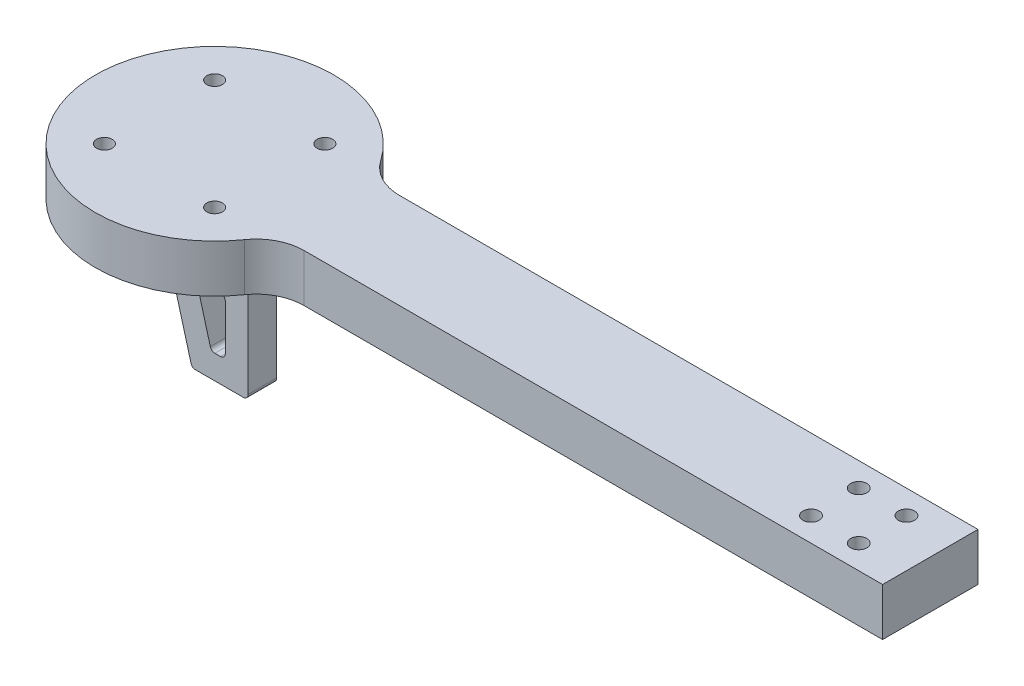
from build123d import *

# Parameters (mm, degrees)
SKETCH1_R            = 1.635
BOSS_EXTRUDE1_DEPTH  = 10
FILLET1_R            = 10
M3_CLEARANCE_HOLE1_D = 3.4
BOSS_EXTRUDE2_DEPTH  = 3


with BuildPart() as part:
    # Sketch1 → Boss-Extrude1 (new body)
    with BuildSketch(Plane(origin=(0, 0, 0), x_dir=(1, 0, 0), z_dir=(0, 1, 0))):
        with BuildLine():
            ThreePointArc((-52.087121525, 10), (-100, 0), (-52.087121525, -10))
            Line((-52.087121525, -10), (75, -10))
            Line((75, -10), (75, 10))
            Line((75, 10), (-52.087121525, 10))
        make_face()
        with Locations(Location((-63.447642962, 11.552357038, 0), (0, 0, 270))):
            Circle(SKETCH1_R, mode=Mode.SUBTRACT)
        with Locations(Location((-63.447642962, -11.552357038, 0), (0, 0, 270))):
            Circle(SKETCH1_R, mode=Mode.SUBTRACT)
        with Locations(Location((-86.552357038, -11.552357038, 0), (0, 0, 270))):
            Circle(SKETCH1_R, mode=Mode.SUBTRACT)
        with Locations(Location((-86.552357038, 11.552357038, 0), (0, 0, 270))):
            Circle(SKETCH1_R, mode=Mode.SUBTRACT)
    extrude(amount=BOSS_EXTRUDE1_DEPTH)

    # Fillet1
    fillet1_edges = [part.edges().sort_by_distance(p)[0] for p in [
        (-52.087121525, 5, -10),
        (-52.087121525, 5, 10),
    ]]
    fillet(fillet1_edges, radius=FILLET1_R)

    # M3 Clearance Hole1 (through all)
    with Locations(Plane(origin=(0, 10, 0), x_dir=(1, 0, 0), z_dir=(0, 1, 0))):
        with Locations((65, 5), (65, -5), (55, 5), (55, -5)):
            Hole(M3_CLEARANCE_HOLE1_D / 2)

    # Sketch4 → Boss-Extrude2 (add, symmetric)
    with BuildSketch(Plane.XY):
        with BuildLine():
            Line((-85, 0), (-65, 0))
            Line((-65, 0), (-64.997725963, -28.999999911))
            ThreePointArc((-64.997725963, -28.999999911), (-65.279885535, -29.725998292), (-65.997288738, -30.029346801))
            Line((-65.997288738, -30.029346801), (-76.240320029, -30.029413508))
            ThreePointArc((-76.240320029, -30.029413508), (-76.711108316, -29.75011129), (-76.964307454, -29.264785072))
            Line((-76.964307454, -29.264785072), (-85, 0))
        make_face()
        with BuildLine():
            Line((-69.759679971, -14.473339505), (-69.759679971, -24))
            ThreePointArc((-69.759679971, -24), (-70.05257319, -24.707106781), (-70.759679971, -25))
            Line((-70.759679971, -25), (-71.947540362, -25))
            ThreePointArc((-71.947540362, -25), (-72.553846773, -24.795231121), (-72.911847816, -24.264785072))
            Line((-72.911847816, -24.264785072), (-75.527732899, -14.738124577))
            ThreePointArc((-75.527732899, -14.738124577), (-75.358656566, -13.867033094), (-74.563425445, -13.473339505))
            Line((-74.563425445, -13.473339505), (-70.759679971, -13.473339505))
            ThreePointArc((-70.759679971, -13.473339505), (-70.05257319, -13.766232724), (-69.759679971, -14.473339505))
        make_face(mode=Mode.SUBTRACT)
        with BuildLine():
            Line((-77.449833051, -7.738124577), (-77.854391063, -6.264785072))
            ThreePointArc((-77.854391063, -6.264785072), (-77.68531473, -5.393693589), (-76.890083609, -5))
            Line((-76.890083609, -5), (-70.759679971, -5))
            ThreePointArc((-70.759679971, -5), (-70.05257319, -5.292893219), (-69.759679971, -6))
            Line((-69.759679971, -6), (-69.759679971, -7.473339505))
            ThreePointArc((-69.759679971, -7.473339505), (-70.05257319, -8.180446286), (-70.759679971, -8.473339505))
            Line((-70.759679971, -8.473339505), (-76.485525597, -8.473339505))
            ThreePointArc((-76.485525597, -8.473339505), (-77.091832008, -8.268570626), (-77.449833051, -7.738124577))
        make_face(mode=Mode.SUBTRACT)
    extrude(amount=BOSS_EXTRUDE2_DEPTH, both=True)


solid = part.part
